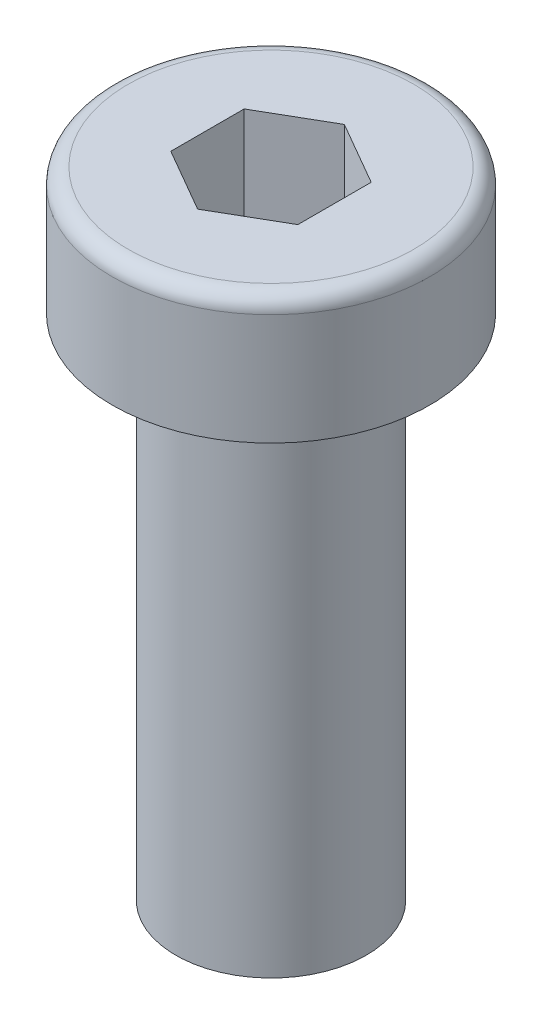
from build123d import *

# Parameters (mm, degrees)
CUT_EXTRUDE1_DEPTH = 3


with BuildPart() as part:
    # Sketch1 → Revolve1 (revolve)
    with BuildSketch(Plane.XY, mode=Mode.PRIVATE) as revolve1_sk:
        with BuildLine():
            Line((0, 20), (-4.5, 20))
            ThreePointArc((-4.5, 20), (-4.853553391, 19.853553391), (-5, 19.5))
            Line((-5, 19.5), (-5, 16))
            Line((-5, 16), (-3, 16))
            Line((-3, 16), (-3, 0))
            Line((-3, 0), (0, 0))
            Line((0, 0), (0, 20))
        make_face()
    revolve(revolve1_sk.sketch.rotate(Axis((0, 0, 0), (0, 1, 0)), 270), axis=Axis((0, 0, 0), (0, 1, 0)))

    # Sketch2 → Cut-Extrude1 (cut)
    with BuildSketch(Plane(origin=(0, 20, 0), x_dir=(1, 0, 0), z_dir=(0, 1, 0))):
        Polygon((0, 2.309401077), (-2, 1.154700538), (-2, -1.154700538), (0, -2.309401077), (2, -1.154700538), (2, 1.154700538), align=None)
    extrude(amount=-CUT_EXTRUDE1_DEPTH, mode=Mode.SUBTRACT)


solid = part.part
